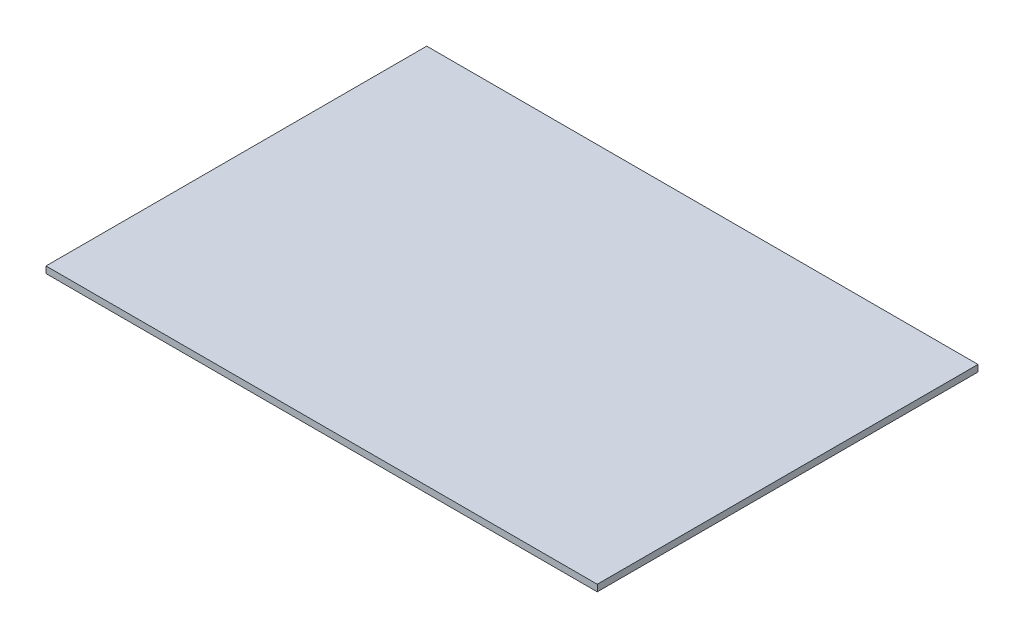
from build123d import *

# Parameters (mm, degrees)
ESQUISSE1_W        = 1500
ESQUISSE1_H        = 1036
BOSS_EXTRU_1_DEPTH = 18


with BuildPart() as part:
    # Esquisse1 → Boss.-Extru.1 (new body)
    with BuildSketch(Plane(origin=(0, 0, 0), x_dir=(1, 0, 0), z_dir=(0, 1, 0))):
        Rectangle(ESQUISSE1_W, ESQUISSE1_H)
    extrude(amount=BOSS_EXTRU_1_DEPTH)


solid = part.part
